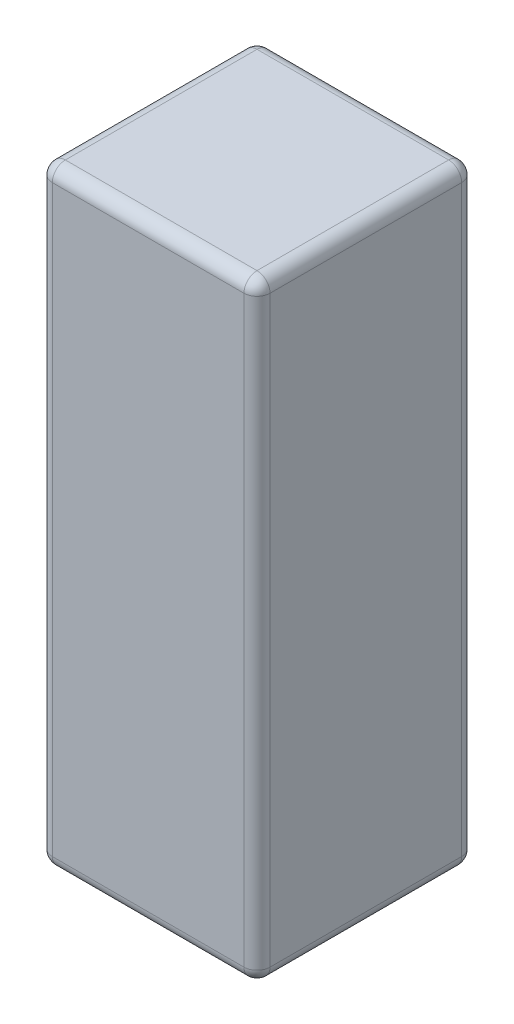
from build123d import *

# Parameters (mm, degrees)
SKETCH_1_W      = 50
SKETCH_1_H      = 50
EXTRUDE_1_DEPTH = 140
FILLET_1_R      = 3


with BuildPart() as part:
    # Эскиз1 → Бобышка-Вытянуть1 (new body)
    with BuildSketch(Plane(origin=(0, 0, 0), x_dir=(1, 0, 0), z_dir=(0, 1, 0))):
        with Locations((25, 25)):
            Rectangle(SKETCH_1_W, SKETCH_1_H)
    extrude(amount=EXTRUDE_1_DEPTH)

    # Скругление1
    fillet_1_edges = [part.edges().sort_by_distance(p)[0] for p in [
        (50, 140, -25),
        (25, 140, -50),
        (0, 140, -25),
        (25, 0, -50),
        (50, 0, -25),
        (25, 0, 0),
        (0, 0, -25),
        (0, 70, -50),
        (50, 70, -50),
        (50, 70, 0),
        (0, 70, 0),
        (25, 140, 0),
    ]]
    fillet(fillet_1_edges, radius=FILLET_1_R)


solid = part.part
